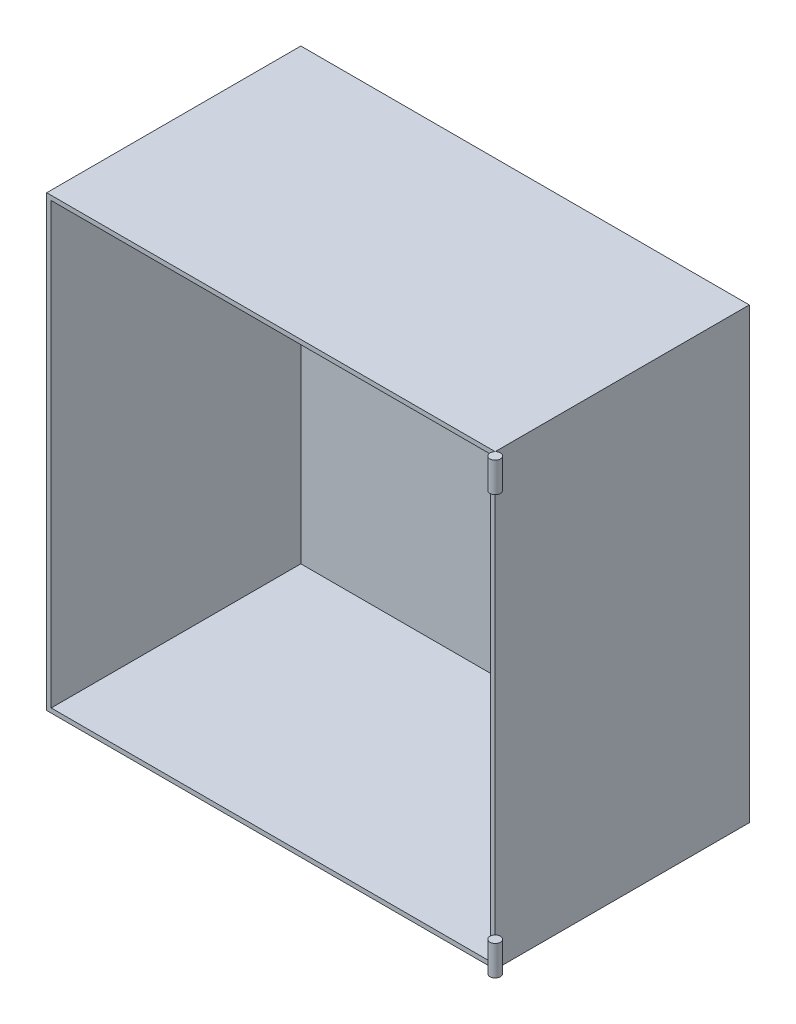
from build123d import *

# Parameters (mm, degrees)
CROQUIS1_W              = 300
CROQUIS1_H              = 300
SALIENTE_EXTRUIR1_DEPTH = 170
CROQUIS2_W              = 294
CROQUIS2_H              = 294
CORTAR_EXTRUIR1_DEPTH   = 167
CROQUIS3_R              = 3.5
SALIENTE_EXTRUIR2_DEPTH = 20
CROQUIS4_R              = 3.5
SALIENTE_EXTRUIR3_DEPTH = 20


with BuildPart() as part:
    # Croquis1 → Saliente-Extruir1 (new body)
    with BuildSketch(Plane.XY):
        with Locations((150, -150)):
            Rectangle(CROQUIS1_W, CROQUIS1_H)
    extrude(amount=SALIENTE_EXTRUIR1_DEPTH)

    # Croquis2 → Cortar-Extruir1 (cut)
    with BuildSketch(Plane.XY.offset(170)):
        with Locations((150, -150)):
            Rectangle(CROQUIS2_W, CROQUIS2_H)
    extrude(amount=-CORTAR_EXTRUIR1_DEPTH, mode=Mode.SUBTRACT)


with BuildPart() as body_2:
    # Croquis3 → Saliente-Extruir2 (new body)
    with BuildSketch(Plane(origin=(0, 0, 0), x_dir=(1, 0, 0), z_dir=(0, 1, 0))):
        with Locations(Location((302.474873734, -172.474873734, 0), (0, 0, 270))):
            Circle(CROQUIS3_R)
    extrude(amount=-SALIENTE_EXTRUIR2_DEPTH)


with BuildPart() as body_3:
    # Croquis4 → Saliente-Extruir3 (new body)
    with BuildSketch(Plane.XZ.offset(300)):
        with Locations((302.474873734, 172.474873734)):
            Circle(CROQUIS4_R)
    extrude(amount=-SALIENTE_EXTRUIR3_DEPTH)


solid = Compound([part.part, body_2.part, body_3.part])
